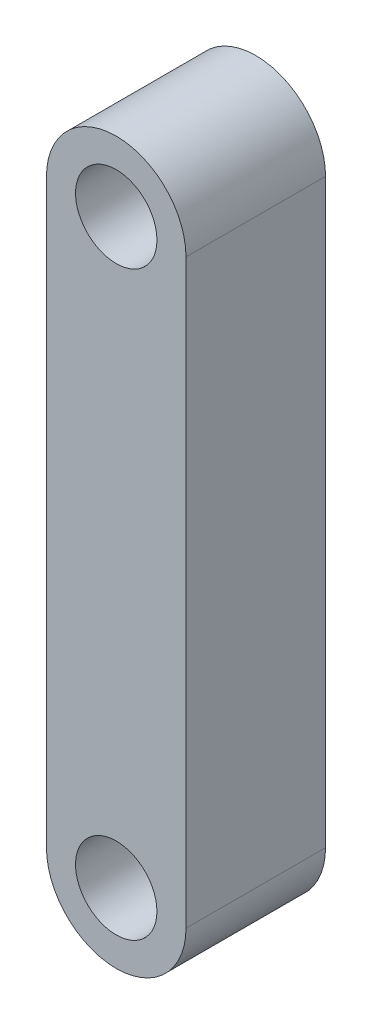
from build123d import *

# Parameters (mm, degrees)
SKETCH1_R           = 3.5
BOSS_EXTRUDE1_DEPTH = 12


with BuildPart() as part:
    # Sketch1 → Boss-Extrude1 (new body)
    with BuildSketch(Plane.XY):
        with BuildLine():
            Line((-6, 0), (-6, -50))
            ThreePointArc((-6, -50), (0, -56), (6, -50))
            Line((6, -50), (6, 0))
            ThreePointArc((6, 0), (0, 6), (-6, 0))
        make_face()
        Circle(SKETCH1_R, mode=Mode.SUBTRACT)
        with Locations((0, -50)):
            Circle(SKETCH1_R, mode=Mode.SUBTRACT)
    extrude(amount=-BOSS_EXTRUDE1_DEPTH)


solid = part.part
